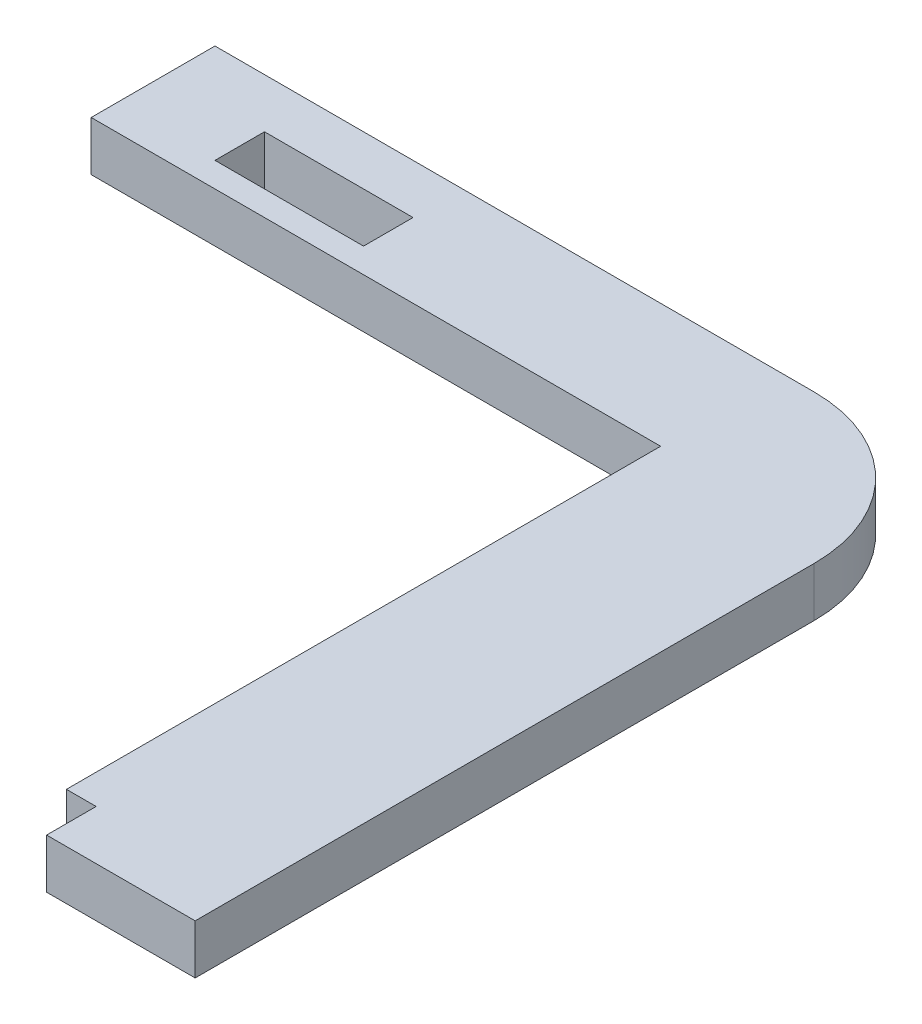
from build123d import *

# Parameters (mm, degrees)
SKETCH1_W           = 15
SKETCH1_H           = 5
BOSS_EXTRUDE1_DEPTH = 5
FILLET3_R           = 15


with BuildPart() as part:
    # Sketch1 → Boss-Extrude1 (new body)
    with BuildSketch(Plane(origin=(0, 0, 0), x_dir=(1, 0, 0), z_dir=(0, 1, 0))):
        Polygon((-26.5, -22.5), (-29.5, -22.5), (-29.5, 37.5), (-87, 37.5), (-87, 50), (-11.5, 50), (-11.5, -27.5), (-26.5, -27.5), align=None)
        with Locations((-69.5, 42.5)):
            Rectangle(SKETCH1_W, SKETCH1_H, mode=Mode.SUBTRACT)
    extrude(amount=BOSS_EXTRUDE1_DEPTH)

    # Fillet3
    fillet3_edges = [part.edges().sort_by_distance(p)[0] for p in [
        (-11.5, 2.5, -50),
    ]]
    fillet(fillet3_edges, radius=FILLET3_R)


solid = part.part
